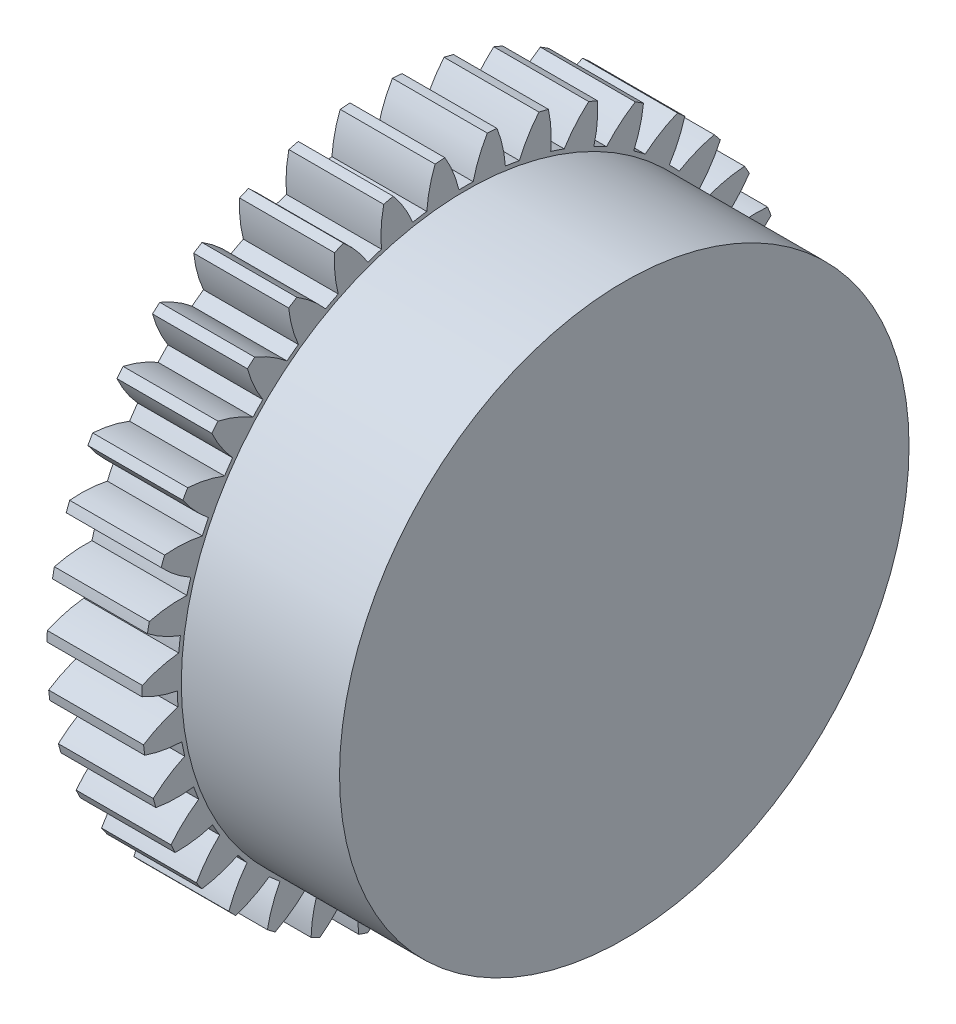
from build123d import *

# Parameters (mm, degrees)
BASPROSKE_W         = 6
BASPROSKE_H         = 20.5
TOOTHCUT_DEPTH      = 30.605742686
TEETHCUTS_COUNT     = 39
TEETHCUTS_ANGLE     = 350.769230769
BORSKE_R            = 11
BORE_DEPTH          = 50.0000508
SKETCH2_R           = 18
BOSS_EXTRUDE1_DEPTH = 10


with BuildPart() as part:
    # BasProSke → Base-Revolve (revolve)
    with BuildSketch(Plane(origin=(0, 0, 0), x_dir=(1, 0, 0), z_dir=(0, 1, 0)), mode=Mode.PRIVATE) as base_revolve_sk:
        with Locations((3, 10.25)):
            Rectangle(BASPROSKE_W, BASPROSKE_H)
    revolve(base_revolve_sk.sketch.rotate(Axis((-10, 0, 0), (1, 0, 0)), 180), axis=Axis((-10, 0, 0), (1, 0, 0)))

    # TooCutSke → ToothCut (cut, through all)
    with BuildSketch(Plane(origin=(0, 0, 0), x_dir=(0, 0, -1), z_dir=(1, 0, 0))):
        with BuildLine():
            ThreePointArc((0.450063598, 18.243449338), (0, 18.249), (-0.450063598, 18.243449338))
            ThreePointArc((-0.450063598, 18.243449338), (-0.816963734, 19.397278425), (-1.358007102, 20.480426311))
            ThreePointArc((-1.358007102, 20.480426311), (0, 20.5254), (1.358007102, 20.480426311))
            ThreePointArc((1.358007102, 20.480426311), (0.816963734, 19.397278425), (0.450063598, 18.243449338))
        make_face()
    toothcut = extrude(amount=TOOTHCUT_DEPTH, mode=Mode.SUBTRACT)

    # TeethCuts: ToothCut ×39 about axis
    teethcuts_axis = Axis((-10, 0, 0), (1, 0, 0))
    for i in range(1, TEETHCUTS_COUNT):
        add(toothcut.rotate(teethcuts_axis, i * TEETHCUTS_ANGLE / (TEETHCUTS_COUNT - 1)), mode=Mode.SUBTRACT)

    # BorSke → Bore (cut, symmetric)
    with BuildSketch(Plane(origin=(0, 0, 0), x_dir=(0, 0, -1), z_dir=(1, 0, 0))):
        with Locations(Location((0, 0, 0), (0, 0, 180))):
            Circle(BORSKE_R)
    extrude(amount=BORE_DEPTH, both=True, mode=Mode.SUBTRACT)

    # Sketch2 → Boss-Extrude1 (add)
    with BuildSketch(Plane(origin=(6, 0, 0), x_dir=(0, 0, -1), z_dir=(1, 0, 0))):
        with Locations(Location((0, 0, 0), (0, 0, 180))):
            Circle(SKETCH2_R)
    extrude(amount=BOSS_EXTRUDE1_DEPTH)


solid = part.part
